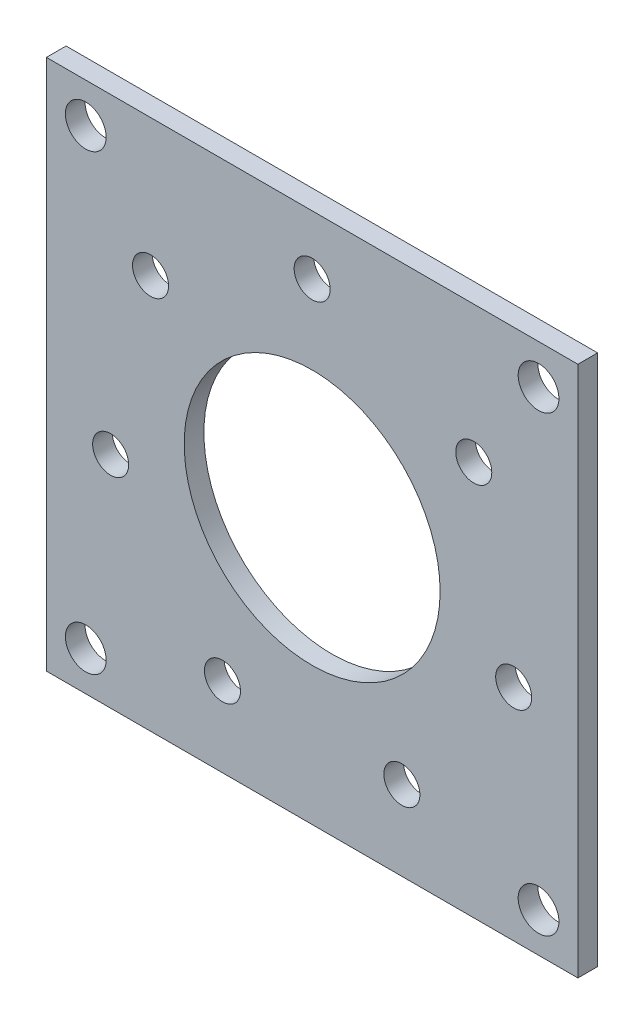
from build123d import *

# Parameters (mm, degrees)
ESBO_O1_W                = 135
ESBO_O1_H                = 135
ESBO_O1_R                = 5.178334598
ESBO_O1_R_2              = 32.5
ESBO_O1_R_3              = 4.576992867
RESSALTO_EXTRUS_O3_DEPTH = 5


with BuildPart() as part:
    # Esboço1 → Ressalto-extrusão3 (new body)
    with BuildSketch(Plane.XY):
        Rectangle(ESBO_O1_W, ESBO_O1_H)
        with Locations((-57.5, 57.5)):
            Circle(ESBO_O1_R, mode=Mode.SUBTRACT)
        with Locations(Location((-57.5, -57.5, 0), (0, 0, 180))):
            Circle(ESBO_O1_R, mode=Mode.SUBTRACT)
        with Locations((57.5, -57.5)):
            Circle(ESBO_O1_R, mode=Mode.SUBTRACT)
        with Locations(Location((57.5, 57.5, 0), (0, 0, 180))):
            Circle(ESBO_O1_R, mode=Mode.SUBTRACT)
        Circle(ESBO_O1_R_2, mode=Mode.SUBTRACT)
        with Locations((0, 52.5)):
            Circle(ESBO_O1_R_3, mode=Mode.SUBTRACT)
        with Locations((41.04615283, 32.733214598)):
            Circle(ESBO_O1_R_3, mode=Mode.SUBTRACT)
        with Locations((51.18371539, -11.682349033)):
            Circle(ESBO_O1_R_3, mode=Mode.SUBTRACT)
        with Locations((22.778896304, -47.300865565)):
            Circle(ESBO_O1_R_3, mode=Mode.SUBTRACT)
        with Locations((-22.778896304, -47.300865565)):
            Circle(ESBO_O1_R_3, mode=Mode.SUBTRACT)
        with Locations((-51.18371539, -11.682349033)):
            Circle(ESBO_O1_R_3, mode=Mode.SUBTRACT)
        with Locations((-41.04615283, 32.733214598)):
            Circle(ESBO_O1_R_3, mode=Mode.SUBTRACT)
    extrude(amount=RESSALTO_EXTRUS_O3_DEPTH)


solid = part.part
